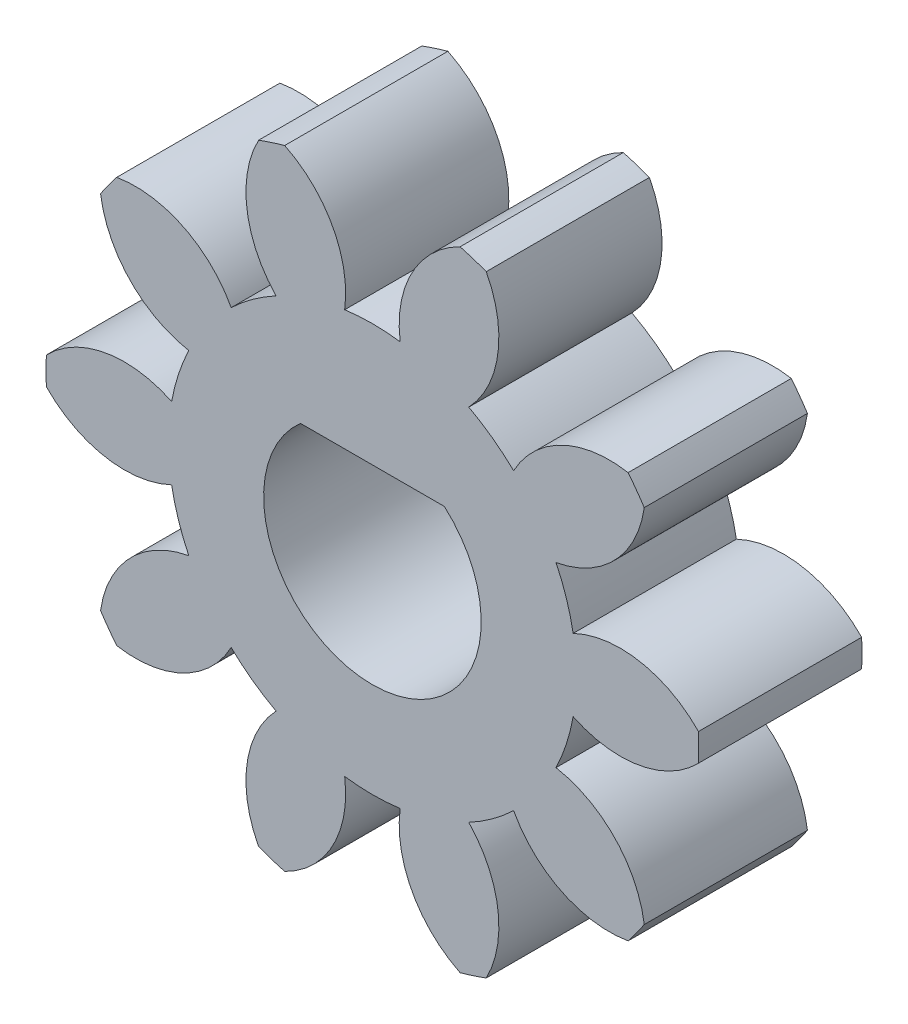
from build123d import *

# Parameters (mm, degrees)
SKETCH1_R           = 6
BOSS_EXTRUDE1_DEPTH = 3
CUT_EXTRUDE1_DEPTH  = 10
CIRPATTERN1_COUNT   = 10
CUT_EXTRUDE3_DEPTH  = 9.854419488


with BuildPart() as part:
    # Sketch1 → Boss-Extrude1 (new body)
    with BuildSketch(Plane.XY):
        Circle(SKETCH1_R)
    extrude(amount=BOSS_EXTRUDE1_DEPTH)

    # Sketch2 → Cut-Extrude1 (cut, through all)
    with BuildSketch(Plane.XY.offset(3)):
        with BuildLine():
            ThreePointArc((-1.61222068, 5.77933772), (-0.72770239, 4.925278691), (-0.50996756, 3.715162592))
            ThreePointArc((-0.50996756, 3.715162592), (0, 3.75), (0.50996756, 3.715162592))
            ThreePointArc((0.50996756, 3.715162592), (0.72770239, 4.925278691), (1.61222068, 5.77933772))
            ThreePointArc((1.61222068, 5.77933772), (0, 6), (-1.61222068, 5.77933772))
        make_face()
    cut_extrude1 = extrude(amount=-CUT_EXTRUDE1_DEPTH, mode=Mode.SUBTRACT)

    # CirPattern1: Cut-Extrude1 ×10 about axis
    cirpattern1_axis = Axis((0, 0, 0), (0, 0, 1))
    for i in range(1, CIRPATTERN1_COUNT):
        add(cut_extrude1.rotate(cirpattern1_axis, i * 360 / CIRPATTERN1_COUNT), mode=Mode.SUBTRACT)

    # Sketch4 → Cut-Extrude3 (cut, through all)
    with BuildSketch(Plane.XY.offset(3)):
        with BuildLine():
            Line((-1.322875656, 1.5), (1.322875656, 1.5))
            ThreePointArc((1.322875656, 1.5), (0, -2), (-1.322875656, 1.5))
        make_face()
    extrude(amount=-CUT_EXTRUDE3_DEPTH, mode=Mode.SUBTRACT)


solid = part.part
